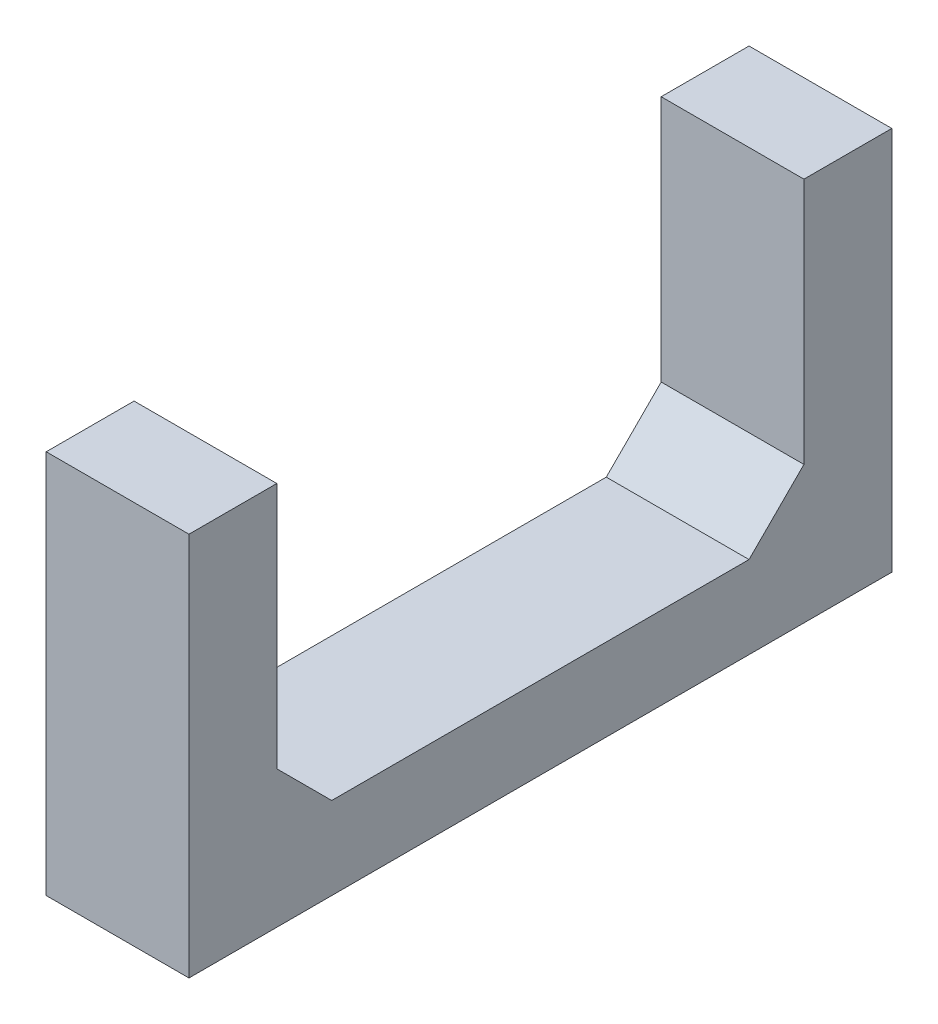
from build123d import *

# Parameters (mm, degrees)
BOSS_EXTRUDE1_DEPTH = 26
CHAMFER1_SIZE       = 10


with BuildPart() as part:
    # Sketch1 → Boss-Extrude1 (new body)
    with BuildSketch(Plane(origin=(0, 0, 0), x_dir=(0, 0, -1), z_dir=(1, 0, 0))):
        Polygon((0, 0), (0, 70.000000066), (16, 70.000000066), (16, 15.000000066), (112, 15.000000066), (112, 70.000000066), (128, 70.000000066), (128, 0), align=None)
    extrude(amount=BOSS_EXTRUDE1_DEPTH)

    # Chamfer1
    chamfer1_edges = [part.edges().sort_by_distance(p)[0] for p in [
        (13, 15.000000066, -16),
        (13, 15.000000066, -112),
    ]]
    chamfer(chamfer1_edges, length=CHAMFER1_SIZE)


solid = part.part
